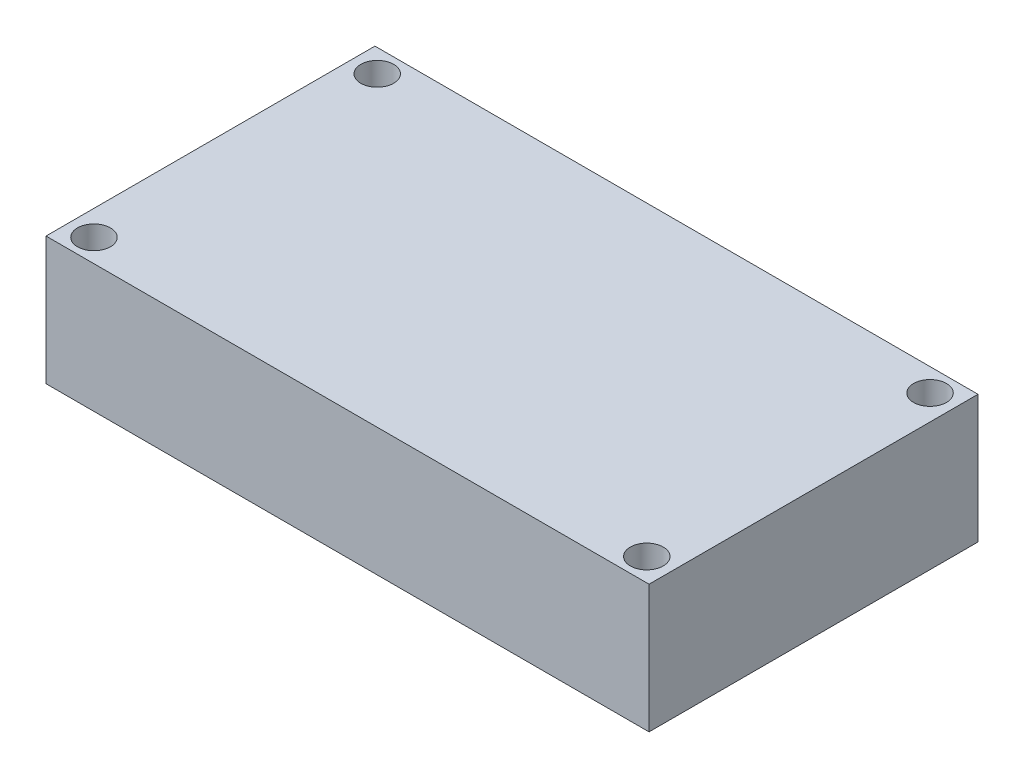
from build123d import *

# Parameters (mm, degrees)
SKETCH2_W            = 66
SKETCH2_H            = 36
BOSS_EXTRUDE1_DEPTH  = 14
M3_CLEARANCE_HOLE1_D = 3.6


with BuildPart() as part:
    # Sketch2 → Boss-Extrude1 (new body)
    with BuildSketch(Plane(origin=(0, 0, 0), x_dir=(1, 0, 0), z_dir=(0, 1, 0))):
        with Locations((33, 18)):
            Rectangle(SKETCH2_W, SKETCH2_H)
    extrude(amount=BOSS_EXTRUDE1_DEPTH)

    # M3 Clearance Hole1 (through all)
    with Locations(Plane(origin=(0, 14, 0), x_dir=(1, 0, 0), z_dir=(0, 1, 0))):
        with Locations((63.25, 33.5), (63.25, 2.5), (2.75, 33.5), (2.75, 2.5)):
            Hole(M3_CLEARANCE_HOLE1_D / 2)


solid = part.part
